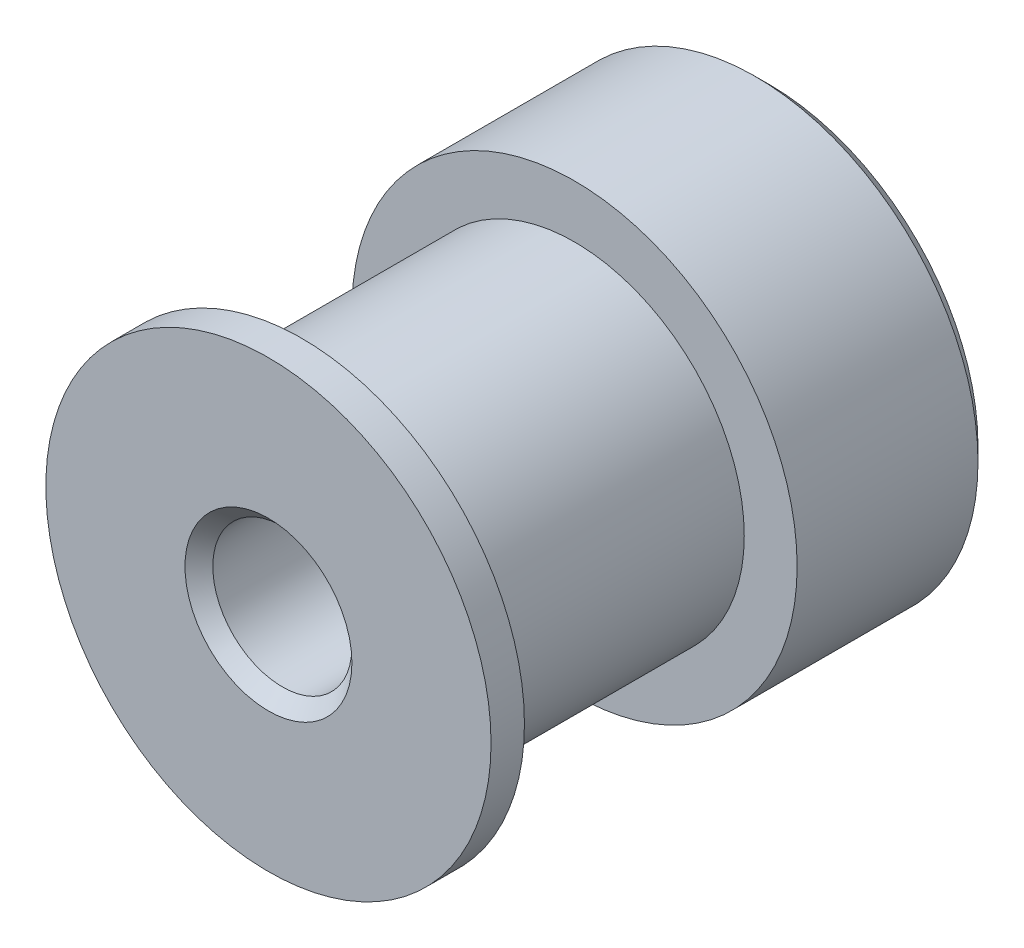
from build123d import *

# Parameters (mm, degrees)
CROQUIS1_R              = 8
SALIENTE_EXTRUIR1_DEPTH = 7
CROQUIS2_R              = 6.1
SALIENTE_EXTRUIR2_DEPTH = 9.8
CROQUIS3_R              = 8
SALIENTE_EXTRUIR3_DEPTH = 1.2
CROQUIS4_R              = 2.5
CORTAR_EXTRUIR1_DEPTH   = 22.260291625
CHAFL_N1_SIZE           = 0.5
CROQUIS5_R              = 1.5
CORTAR_EXTRUIR2_DEPTH   = 22.260291625
CROQUIS6_R              = 1.5
CORTAR_EXTRUIR3_DEPTH   = 22.260291701


with BuildPart() as part:
    # Croquis1 → Saliente-Extruir1 (new body)
    with BuildSketch(Plane.XY):
        Circle(CROQUIS1_R)
    extrude(amount=SALIENTE_EXTRUIR1_DEPTH)

    # Croquis2 → Saliente-Extruir2 (add)
    with BuildSketch(Plane.XY.offset(7)):
        Circle(CROQUIS2_R)
    extrude(amount=SALIENTE_EXTRUIR2_DEPTH)

    # Croquis3 → Saliente-Extruir3 (add)
    with BuildSketch(Plane.XY.offset(16.8)):
        Circle(CROQUIS3_R)
    extrude(amount=SALIENTE_EXTRUIR3_DEPTH)

    # Croquis4 → Cortar-Extruir1 (cut, through all)
    with BuildSketch(Plane.XY.offset(18)):
        Circle(CROQUIS4_R)
    extrude(amount=-CORTAR_EXTRUIR1_DEPTH, mode=Mode.SUBTRACT)

    # Chaflán1
    chafl_n1_edges = [part.edges().sort_by_distance(p)[0] for p in [
        (-2.5, 0, 0),
        (-2.5, 0, 18),
        (-8, 0, 0),
    ]]
    chamfer(chafl_n1_edges, length=CHAFL_N1_SIZE)

    # Croquis5 → Cortar-Extruir2 (cut, through all)
    with BuildSketch(Plane(origin=(0, 0, 0), x_dir=(0, 0, -1), z_dir=(1, 0, 0))):
        with Locations((-3.5, 0)):
            Circle(CROQUIS5_R)
    extrude(amount=-CORTAR_EXTRUIR2_DEPTH, mode=Mode.SUBTRACT)

    # Croquis6 → Cortar-Extruir3 (cut, through all)
    with BuildSketch(Plane(origin=(0, 0, 0), x_dir=(1, 0, 0), z_dir=(0, 1, 0))):
        with Locations(Location((0, -3.5, 0), (0, 0, 270))):
            Circle(CROQUIS6_R)
    extrude(amount=-CORTAR_EXTRUIR3_DEPTH, mode=Mode.SUBTRACT)


solid = part.part
